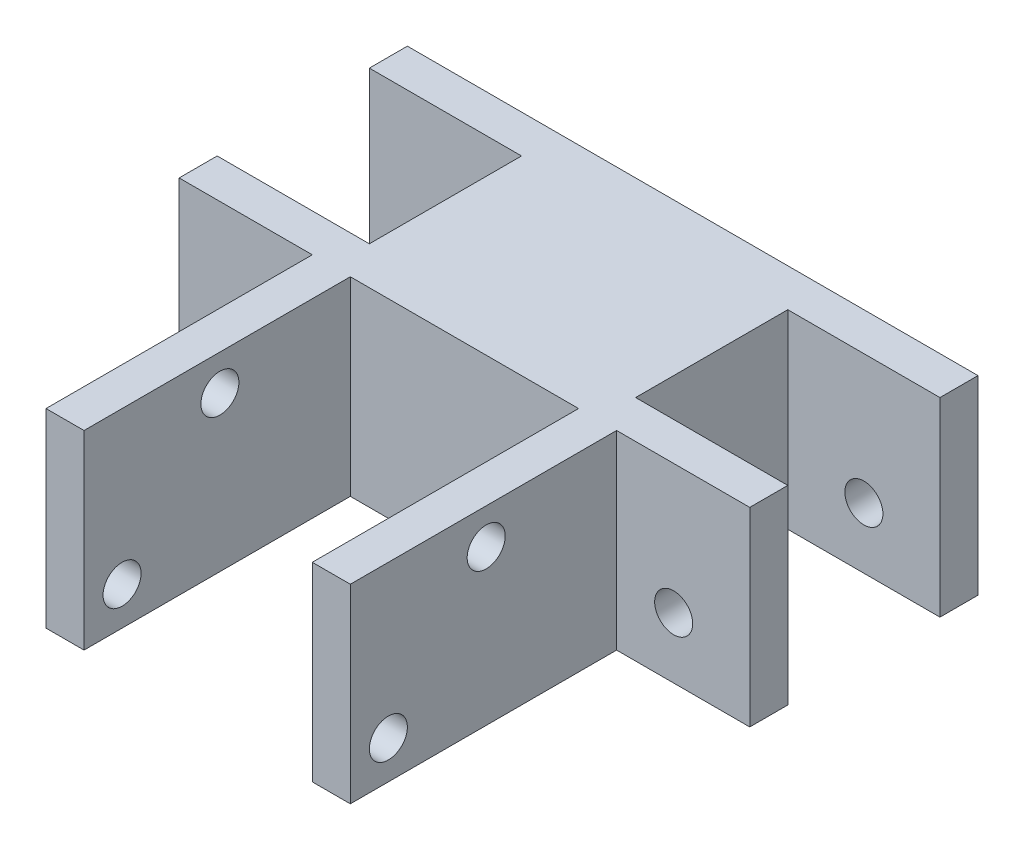
from build123d import *

# Parameters (mm, degrees)
BOSS_EXTRUDE1_DEPTH = 31.75
SKETCH2_R           = 3.175
CUT_EXTRUDE1_DEPTH  = 6.35
SKETCH4_R           = 3.175
CUT_EXTRUDE2_DEPTH  = 6.35


with BuildPart() as part:
    # Sketch1 → Boss-Extrude1 (new body)
    with BuildSketch(Plane(origin=(0, 0, 0), x_dir=(1, 0, 0), z_dir=(0, 1, 0))):
        Polygon((-22.225, 19.05), (22.225, 19.05), (47.625, 19.05), (47.625, 12.7), (22.225, 12.7), (22.225, -12.7), (47.625, -12.7), (47.625, -19.05), (25.4, -19.05), (25.4, -63.5), (19.05, -63.5), (19.05, -19.05), (-19.05, -19.05), (-19.05, -63.5), (-25.4, -63.5), (-25.4, -19.05), (-47.625, -19.05), (-47.625, -12.7), (-22.225, -12.7), (-22.225, 12.7), (-47.625, 12.7), (-47.625, 19.05), align=None)
    extrude(amount=BOSS_EXTRUDE1_DEPTH)

    # Sketch2 → Cut-Extrude1 (cut)
    with BuildSketch(Plane.XY.offset(19.05)):
        with Locations((34.925, 10.16)):
            Circle(SKETCH2_R)
        with Locations((-34.925, 10.16)):
            Circle(SKETCH2_R)
    cut_extrude1 = extrude(amount=-CUT_EXTRUDE1_DEPTH, mode=Mode.SUBTRACT)

    # Mirror1: Cut-Extrude1 across plane
    add(cut_extrude1.mirror(Plane.XY), mode=Mode.SUBTRACT)

    # Sketch4 → Cut-Extrude2 (cut)
    with BuildSketch(Plane.ZY.offset(25.4)):
        with Locations((40.823194714, 25.807528855)):
            Circle(SKETCH4_R)
        with Locations((57.15, 6.35)):
            Circle(SKETCH4_R)
    cut_extrude2 = extrude(amount=-CUT_EXTRUDE2_DEPTH, mode=Mode.SUBTRACT)

    # Mirror2: Cut-Extrude2 across plane
    add(cut_extrude2.mirror(Plane(origin=(0, 0, 0), x_dir=(0, 0, 1), z_dir=(1, 0, 0))), mode=Mode.SUBTRACT)


solid = part.part
